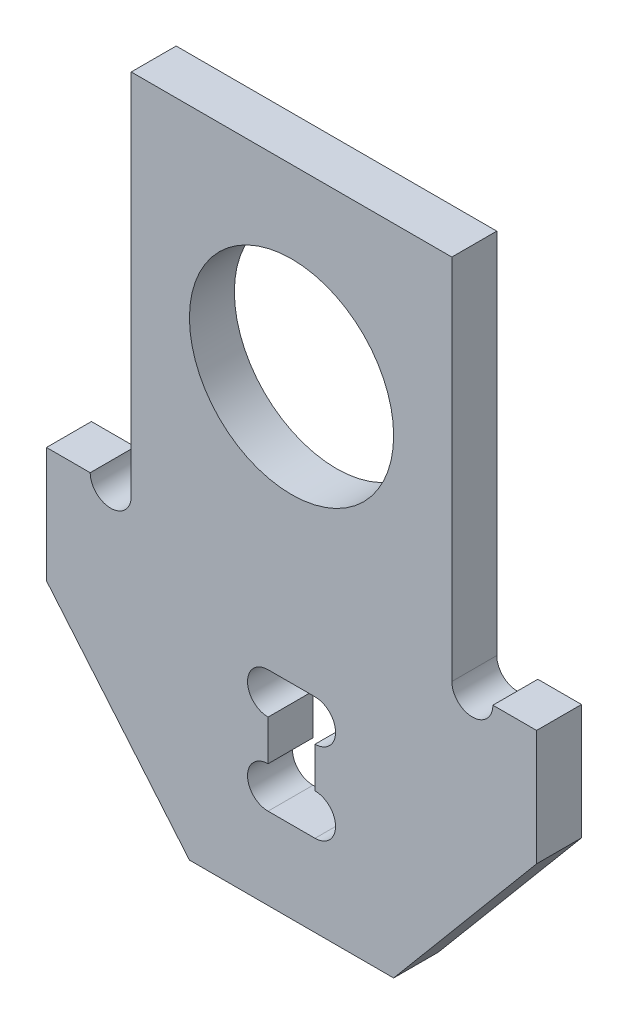
from build123d import *

# Parameters (mm, degrees)
SKETCH_1_R      = 5
EXTRUDE_1_DEPTH = 2.2


with BuildPart() as part:
    # 草图1 → 凸台-拉伸1 (new body)
    with BuildSketch(Plane.XY):
        with BuildLine():
            Line((-7.85, 9), (-7.85, -9))
            ThreePointArc((-7.85, -9), (-8.855, -10.005), (-9.86, -9))
            Line((-9.86, -9), (-12, -9))
            Line((-12, -9), (-12, -14.657724852))
            Line((-12, -14.657724852), (-5, -23))
            Line((-5, -23), (5, -23))
            Line((5, -23), (12, -14.657724852))
            Line((12, -14.657724852), (12, -9))
            Line((12, -9), (9.86, -9))
            ThreePointArc((9.86, -9), (8.855, -10.005), (7.85, -9))
            Line((7.85, -9), (7.85, 9))
            Line((7.85, 9), (-7.85, 9))
        make_face()
        with BuildLine():
            ThreePointArc((2.155, -17.995), (1.860642315, -18.705642315), (1.15, -19))
            Line((1.15, -19), (-1.15, -19))
            ThreePointArc((-1.15, -19), (-2.155, -17.995), (-1.15, -16.99))
            Line((-1.15, -16.99), (-1.15, -15.01))
            ThreePointArc((-1.15, -15.01), (-2.155, -14.005), (-1.15, -13))
            Line((-1.15, -13), (1.15, -13))
            ThreePointArc((1.15, -13), (1.860642315, -13.294357685), (2.155, -14.005))
            ThreePointArc((2.155, -14.005), (1.860642315, -14.715642315), (1.15, -15.01))
            Line((1.15, -15.01), (1.15, -16.99))
            ThreePointArc((1.15, -16.99), (1.860642315, -17.284357685), (2.155, -17.995))
        make_face(mode=Mode.SUBTRACT)
        Circle(SKETCH_1_R, mode=Mode.SUBTRACT)
    extrude(amount=EXTRUDE_1_DEPTH)


solid = part.part
